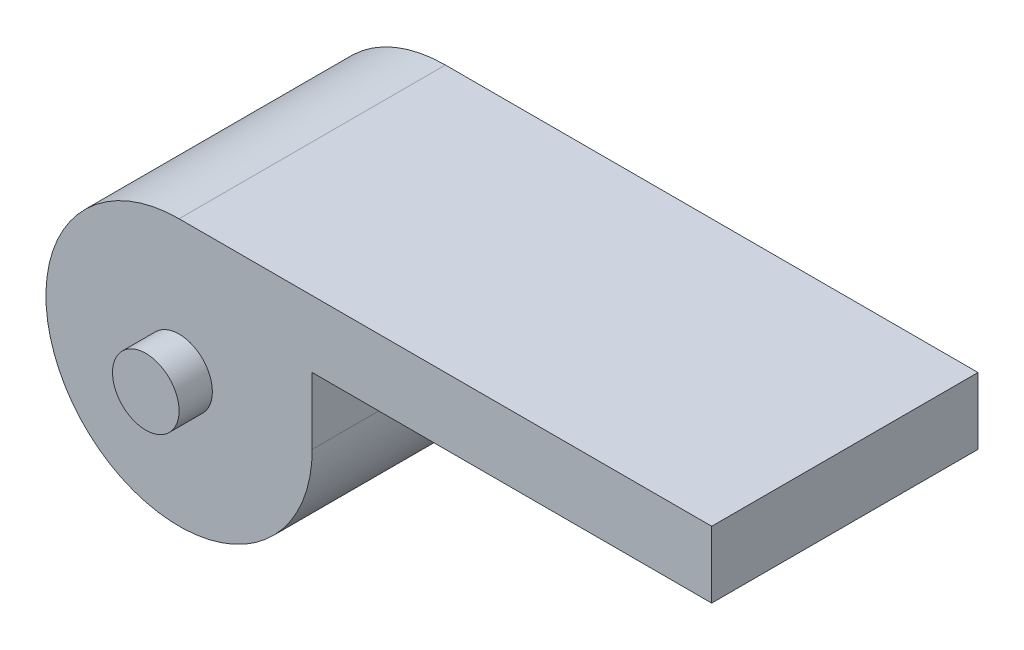
from build123d import *

# Parameters (mm, degrees)
SKETCH1_R                = 1.5875
BOSS_EXTRUDE1_DEPTH      = 12.7
BOSS_EXTRUDE2_DEPTH      = 14.2875
BOSS_EXTRUDE2_DEPTH_BACK = 1.5875
SKETCH1_3_R              = 1.5875


with BuildPart() as part:
    # Sketch1 → Boss-Extrude1 (new body)
    with BuildSketch(Plane.XY):
        with BuildLine():
            Line((25.4, 6.35), (0, 6.35))
            ThreePointArc((0, 6.35), (-4.490128061, -4.490128061), (6.35, 0))
            Line((6.35, 0), (6.35, 3.175))
            Line((6.35, 3.175), (25.4, 3.175))
            Line((25.4, 3.175), (25.4, 6.35))
        make_face()
        Circle(SKETCH1_R, mode=Mode.SUBTRACT)
    extrude(amount=BOSS_EXTRUDE1_DEPTH)

    # Sketch1<3> → Boss-Extrude2 (add, two sides: drawn at the far end of the back side and taken through both)
    with BuildSketch(Plane.XY.offset(-BOSS_EXTRUDE2_DEPTH_BACK)):
        Circle(SKETCH1_3_R)
    extrude(amount=BOSS_EXTRUDE2_DEPTH + BOSS_EXTRUDE2_DEPTH_BACK)


solid = part.part
